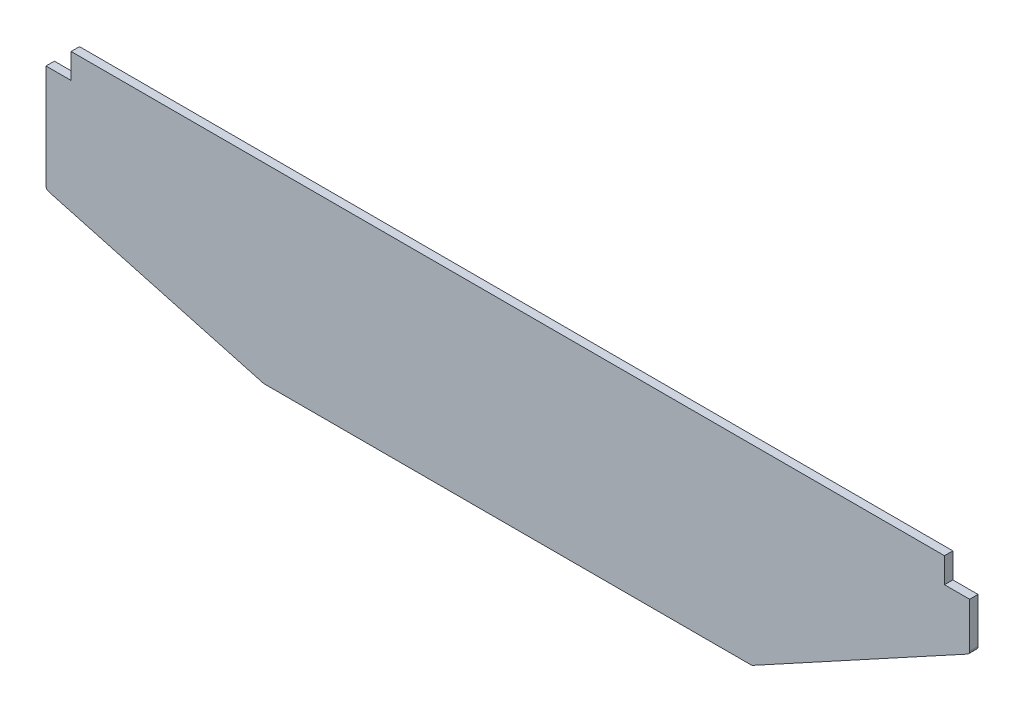
from build123d import *

# Parameters (mm, degrees)
BOSS_EXTRUDE1_DEPTH = 6.35
SKETCH2_W           = 19.05
SKETCH2_H           = 19.05
CUT_EXTRUDE1_DEPTH  = 715.888328692


with BuildPart() as part:
    # Sketch1 → Boss-Extrude1 (new body)
    with BuildSketch(Plane.XY):
        with BuildLine():
            Line((700, -53.219100704), (700, 0))
            Line((700, 0), (0, 0))
            Line((0, 0), (0, -97.708612477))
            ThreePointArc((0, -97.708612477), (0.615879968, -99.529593442), (2.210647783, -100.602903941))
            Line((2.210647783, -100.602903941), (164.612402034, -144.894291464))
            ThreePointArc((164.612402034, -144.894291464), (165.003554798, -144.97345543), (165.401754251, -145))
            Line((165.401754251, -145), (534.235017957, -145))
            ThreePointArc((534.235017957, -145), (534.976280341, -144.906979546), (535.671574349, -144.633686719))
            Line((535.671574349, -144.633686719), (698.436556392, -55.852787423))
            ThreePointArc((698.436556392, -55.852787423), (699.579696608, -54.750493995), (700, -53.219100704))
        make_face()
    extrude(amount=BOSS_EXTRUDE1_DEPTH)

    # Sketch2 → Cut-Extrude1 (cut, through all)
    with BuildSketch(Plane.XY.offset(6.35)):
        with Locations((9.525, -9.525)):
            Rectangle(SKETCH2_W, SKETCH2_H)
        with Locations((690.475, -9.525)):
            Rectangle(SKETCH2_W, SKETCH2_H)
    extrude(amount=-CUT_EXTRUDE1_DEPTH, mode=Mode.SUBTRACT)


solid = part.part
